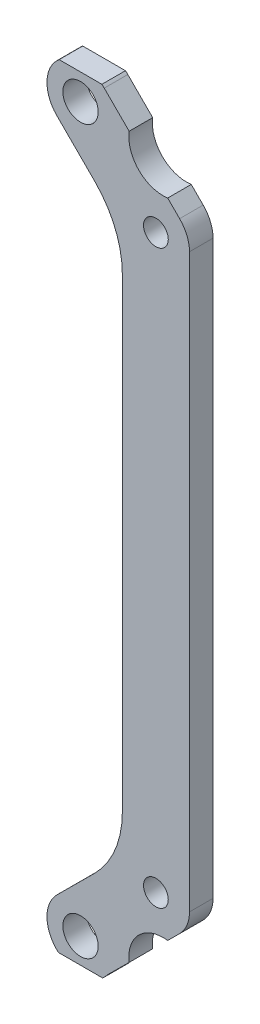
from build123d import *

# Parameters (mm, degrees)
SKIZZE1_R                       = 2.85
SKIZZE1_R_2                     = 1.05
LINEAR_AUSTRAGEN_D_NN1_DEPTH    = 2
LINEAR_AUSTRAGEN_D_NN1_2_DEPTH  = 2
LINEAR_AUSTRAGEN_D_NN1_3_DEPTH  = 2
LINEAR_AUSTRAGEN_D_NN1_4_DEPTH  = 2
AUFSATZ_LINEAR_AUSTRAGEN1_DEPTH = 2
SKIZZE4_R                       = 2.9
SCHNITT_LINEAR_AUSTRAGEN1_DEPTH = 2
SKIZZE7_R                       = 1.5
SCHNITT_LINEAR_AUSTRAGEN3_DEPTH = 4.5
VERRUNDUNG3_R                   = 8
VERRUNDUNG4_R                   = 8
SKIZZE8_W                       = 8.364298592
SKIZZE8_H                       = 2.396021337
SKIZZE8_W_2                     = 8.747208858
SKIZZE8_H_2                     = 3.084567941
SCHNITT_LINEAR_AUSTRAGEN4_DEPTH = 10


with BuildPart() as part:
    # Skizze1 → Linear-Austragen-Dünn1 (new body)
    with BuildSketch(Plane.XY):
        with Locations((43.573867598, -31.049552882)):
            Circle(SKIZZE1_R)
        with Locations((43.573867598, -31.049552882)):
            Circle(SKIZZE1_R_2, mode=Mode.SUBTRACT)
    extrude(amount=LINEAR_AUSTRAGEN_D_NN1_DEPTH)



with BuildPart() as body_2:
    # Skizze1 → Linear-Austragen-D_nn1 2 (new body)
    with BuildSketch(Plane.XY):
        with Locations((49.973867598, -24.649552882)):
            Circle(SKIZZE1_R)
        with Locations((49.973867598, -24.649552882)):
            Circle(SKIZZE1_R_2, mode=Mode.SUBTRACT)
    extrude(amount=LINEAR_AUSTRAGEN_D_NN1_2_DEPTH)


with BuildPart() as body_3:
    # Skizze1 → Linear-Austragen-D_nn1 3 (new body)
    with BuildSketch(Plane.XY):
        with Locations((49.973867598, 23.890447118)):
            Circle(SKIZZE1_R)
        with Locations((49.973867598, 23.890447118)):
            Circle(SKIZZE1_R_2, mode=Mode.SUBTRACT)
    extrude(amount=LINEAR_AUSTRAGEN_D_NN1_3_DEPTH)


with BuildPart() as body_4:
    # Skizze1 → Linear-Austragen-D_nn1 4 (new body)
    with BuildSketch(Plane.XY):
        with Locations((43.573867598, 30.290447118)):
            Circle(SKIZZE1_R)
        with Locations((43.573867598, 30.290447118)):
            Circle(SKIZZE1_R_2, mode=Mode.SUBTRACT)
    extrude(amount=LINEAR_AUSTRAGEN_D_NN1_4_DEPTH)


with BuildPart() as part_1:
    add(part.part)

    add(body_2.part)  # Aufsatz-Linear austragen1 merges body 2

    add(body_3.part)  # Aufsatz-Linear austragen1 merges body 3

    add(body_4.part)  # Aufsatz-Linear austragen1 merges body 4
    # Skizze3 → Aufsatz-Linear austragen1 (add)
    with BuildSketch(Plane(origin=(0, 0, 0), x_dir=(-1, 0, 0), z_dir=(0, 0, -1))):
        Polygon((-41.562362318, -29.03055647), (-47.123867598, -23.489686183), (-47.123867598, -24.649552882), (-48.59326597, -26.13202553), (-51.989121924, -26.664807209), (-45.264844081, -33.343697283), (-44.884208679, -29.808371771), align=None)
        with BuildLine():
            Line((-47.123867598, 22.709939373), (-47.958612175, 21.875193888))
            ThreePointArc((-47.958612175, 21.875193888), (-51.064514663, 21.257390153), (-52.823867598, 23.890447118))
            Line((-52.823867598, 23.890447118), (-52.823867598, -24.649552882))
            Line((-52.823867598, -24.649552882), (-50.178691981, -22.827758624))
            Line((-50.178691981, -22.827758624), (-47.123867598, -24.649552882))
            Line((-47.123867598, -24.649552882), (-47.123867598, -23.489686183))
            Line((-47.123867598, -23.489686183), (-47.123867598, 22.709939373))
        make_face()
        with BuildLine():
            ThreePointArc((-47.123867598, 23.890447118), (-47.340810633, 22.799800052), (-47.958612175, 21.875193888))
            Line((-47.958612175, 21.875193888), (-47.123867598, 22.709939373))
            Line((-47.123867598, 22.709939373), (-41.562362318, 28.271450706))
            Line((-41.562362318, 28.271450706), (-44.884208679, 28.654046934))
            Line((-44.884208679, 28.654046934), (-45.589121924, 32.305701444))
            Line((-45.589121924, 32.305701444), (-51.989121924, 25.905701444))
            ThreePointArc((-51.989121924, 25.905701444), (-48.883219815, 26.523503785), (-47.123867598, 23.890447118))
        make_face()
    extrude(amount=-AUFSATZ_LINEAR_AUSTRAGEN1_DEPTH)

    # Skizze4 → Schnitt-Linear austragen1 (cut)
    with BuildSketch(Plane(origin=(0, 0, 0), x_dir=(-1, 0, 0), z_dir=(0, 0, -1))):
        with Locations((-50.573867598, 29.790447118)):
            Circle(SKIZZE4_R)
        with Locations((-50.573867598, -30.549552882)):
            Circle(SKIZZE4_R)
    extrude(amount=-SCHNITT_LINEAR_AUSTRAGEN1_DEPTH, mode=Mode.SUBTRACT)

    # Skizze7 → Schnitt-Linear austragen3 (cut)
    with BuildSketch(Plane.XY.offset(2)):
        with Locations((43.573867598, -31.049552882)):
            Circle(SKIZZE7_R)
        with Locations((43.573867598, 30.290447118)):
            Circle(SKIZZE7_R)
    extrude(amount=-SCHNITT_LINEAR_AUSTRAGEN3_DEPTH, mode=Mode.SUBTRACT)

    # Verrundung3
    verrundung3_edges = [part_1.edges().sort_by_distance(p)[0] for p in [
        (47.123867598, 22.709939373, 1),
    ]]
    fillet(verrundung3_edges, radius=VERRUNDUNG3_R)

    # Verrundung4
    verrundung4_edges = [part_1.edges().sort_by_distance(p)[0] for p in [
        (47.123867598, -23.489686183, 1),
    ]]
    fillet(verrundung4_edges, radius=VERRUNDUNG4_R)

    # Skizze8 → Schnitt-Linear austragen4 (cut)
    with BuildSketch(Plane(origin=(0, 0, 0), x_dir=(-1, 0, 0), z_dir=(0, 0, -1))):
        with Locations((-42.948718638, 33.685978487)):
            Rectangle(SKIZZE8_W, SKIZZE8_H)
        with Locations((-43.64204941, -34.737574597)):
            Rectangle(SKIZZE8_W_2, SKIZZE8_H_2)
    extrude(amount=-SCHNITT_LINEAR_AUSTRAGEN4_DEPTH, mode=Mode.SUBTRACT)


solid = part_1.part
